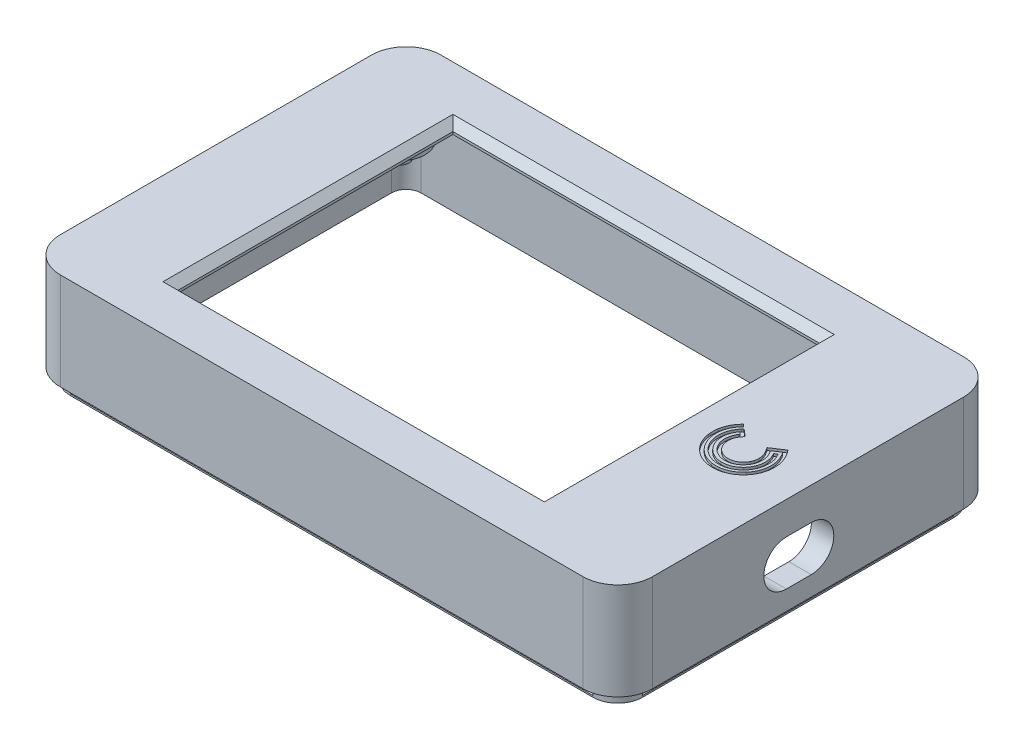
from build123d import *

# Parameters (mm, degrees)
ESQUISSE1_W                 = 92
ESQUISSE1_H                 = 58
ESQUISSE1_W_2               = 58.9
ESQUISSE1_H_2               = 44.2
BOSS_EXTRU_1_DEPTH          = 1.6
CONG_1_R                    = 4
CHANFREIN1_SIZE             = 1.2
ESQUISSE12_R                = 4
BOSS_EXTRU_2_DEPTH          = 4
ESQUISSE13_R                = 1.45
BOSS_EXTRU_3_DEPTH          = 6.4
EXTRU_MINCE3_DEPTH          = 16
EXTRU_MINCE4_DEPTH          = 14
EXTRU_MINCE4_DEPTH_BACK     = 1.6
ENL_V_MAT_EXTRU_3_OK_DEPTH  = 50
ENL_V_MAT_EXTRU_4_OK_DEPTH  = 50
ENL_V_MAT_EXTRU_5_DEPTH     = 84
ENL_V_MAT_EXTRU_8_DEPTH     = 0.4
EXTRU_MINCE5_DEPTH          = 3.6
ENL_V_MAT_EXTRU_11_OK_DEPTH = 4
ENL_V_MAT_EXTRU_15_DEPTH    = 84


with BuildPart() as part:
    # Esquisse1 → Boss.-Extru.1 (new body)
    with BuildSketch(Plane(origin=(0, 0, 0), x_dir=(1, 0, 0), z_dir=(0, 1, 0))):
        Rectangle(ESQUISSE1_W, ESQUISSE1_H)
        with Locations((-2.15, 0)):
            Rectangle(ESQUISSE1_W_2, ESQUISSE1_H_2, mode=Mode.SUBTRACT)
    extrude(amount=BOSS_EXTRU_1_DEPTH)

    # Congé1
    cong_1_edges = [part.edges().sort_by_distance(p)[0] for p in [
        (46, 0.8, 29),
        (-46, 0.8, 29),
        (-46, 0.8, -29),
        (46, 0.8, -29),
    ]]
    fillet(cong_1_edges, radius=CONG_1_R)

    # Chanfrein1
    chanfrein1_edges = [part.edges().sort_by_distance(p)[0] for p in [
        (27.3, 1.6, 0),
        (-2.15, 1.6, -22.1),
        (-31.6, 1.6, 0),
        (-2.15, 1.6, 22.1),
    ]]
    chamfer(chanfrein1_edges, length=CHANFREIN1_SIZE)

    # Esquisse12 → Boss.-Extru.2 (add)
    with BuildSketch(Plane.XZ):
        with Locations(Location((-39, 21, 0), (0, 0, 90))):
            Circle(ESQUISSE12_R)
        with Locations(Location((-39, -21, 0), (0, 0, 90))):
            Circle(ESQUISSE12_R)
        with Locations(Location((39, 21, 0), (0, 0, 90))):
            Circle(ESQUISSE12_R)
        with Locations(Location((39, -21, 0), (0, 0, 90))):
            Circle(ESQUISSE12_R)
    extrude(amount=BOSS_EXTRU_2_DEPTH)

    # Esquisse13 → Boss.-Extru.3 (add)
    with BuildSketch(Plane.XZ):
        with Locations(Location((-39, 21, 0), (0, 0, 270))):
            Circle(ESQUISSE13_R)
        with Locations(Location((-39, -21, 0), (0, 0, 270))):
            Circle(ESQUISSE13_R)
        with Locations(Location((39, -21, 0), (0, 0, 270))):
            Circle(ESQUISSE13_R)
        with Locations(Location((39, 21, 0), (0, 0, 270))):
            Circle(ESQUISSE13_R)
    extrude(amount=BOSS_EXTRU_3_DEPTH)

    # Esquisse32 → Extru.-Mince3 (add)
    with BuildSketch(Plane.XZ):
        with BuildLine():
            Line((46, -25), (46, 25))
            ThreePointArc((46, 25), (44.828427125, 27.828427125), (42, 29))
            Line((42, 29), (-42, 29))
            ThreePointArc((-42, 29), (-44.828427125, 27.828427125), (-46, 25))
            Line((-46, 25), (-46, -25))
            ThreePointArc((-46, -25), (-44.828427125, -27.828427125), (-42, -29))
            Line((-42, -29), (42, -29))
            ThreePointArc((42, -29), (44.828427125, -27.828427125), (46, -25))
        make_face()
        with BuildLine():
            Line((44.4, -25), (44.4, 25))
            ThreePointArc((44.4, 25), (43.697056275, 26.697056275), (42, 27.4))
            Line((42, 27.4), (-42, 27.4))
            ThreePointArc((-42, 27.4), (-43.697056275, 26.697056275), (-44.4, 25))
            Line((-44.4, 25), (-44.4, -25))
            ThreePointArc((-44.4, -25), (-43.697056275, -26.697056275), (-42, -27.4))
            Line((-42, -27.4), (42, -27.4))
            ThreePointArc((42, -27.4), (43.697056275, -26.697056275), (44.4, -25))
        make_face(mode=Mode.SUBTRACT)
    extrude(amount=EXTRU_MINCE3_DEPTH)

    # Esquisse32<2> → Extru.-Mince4 (add, two sides: drawn at the far end of the back side and taken through both)
    with BuildSketch(Plane.XZ.offset(-EXTRU_MINCE4_DEPTH_BACK)):
        with BuildLine():
            Line((47.6, -25), (47.6, 25))
            ThreePointArc((47.6, 25), (45.959797975, 28.959797975), (42, 30.6))
            Line((42, 30.6), (-42, 30.6))
            ThreePointArc((-42, 30.6), (-45.959797975, 28.959797975), (-47.6, 25))
            Line((-47.6, 25), (-47.6, -25))
            ThreePointArc((-47.6, -25), (-45.959797975, -28.959797975), (-42, -30.6))
            Line((-42, -30.6), (42, -30.6))
            ThreePointArc((42, -30.6), (45.959797975, -28.959797975), (47.6, -25))
        make_face()
        with BuildLine():
            Line((46, -25), (46, 25))
            ThreePointArc((46, 25), (44.828427125, 27.828427125), (42, 29))
            Line((42, 29), (-42, 29))
            ThreePointArc((-42, 29), (-44.828427125, 27.828427125), (-46, 25))
            Line((-46, 25), (-46, -25))
            ThreePointArc((-46, -25), (-44.828427125, -27.828427125), (-42, -29))
            Line((-42, -29), (42, -29))
            ThreePointArc((42, -29), (44.828427125, -27.828427125), (46, -25))
        make_face(mode=Mode.SUBTRACT)
    extrude(amount=EXTRU_MINCE4_DEPTH + EXTRU_MINCE4_DEPTH_BACK)

    # Esquisse3D2 → Enlèv. mat.-Extru.3 ok (cut)
    with BuildSketch(Plane(origin=(-46, -15, -25), x_dir=(0, -1, 0), z_dir=(0, 0, 1))):
        Polygon((0, 0), (0.75, 0), (0, 0.75), (-0.75, 0), align=None)
    extrude(amount=ENL_V_MAT_EXTRU_3_OK_DEPTH, mode=Mode.SUBTRACT)

    # Esquisse3D3 → Enlèv. mat.-Extru.4 ok (cut)
    with BuildSketch(Plane(origin=(46, -15, -25), x_dir=(0, -1, 0), z_dir=(0, 0, -1))):
        Polygon((0, 0), (0.75, 0), (0, 0.75), (-0.75, 0), align=None)
    extrude(amount=-ENL_V_MAT_EXTRU_4_OK_DEPTH, mode=Mode.SUBTRACT)

    # Esquisse3D4 → Enlèv. mat.-Extru.5 (cut)
    with BuildSketch(Plane(origin=(42, -15, 29), x_dir=(0, 1, 0), z_dir=(-1, 0, 0))):
        Polygon((0, 0), (0.75, 0), (0, 0.75), (-0.75, 0), align=None)
    extrude(amount=ENL_V_MAT_EXTRU_5_DEPTH, mode=Mode.SUBTRACT)

    # Esquisse45 → Enlèv. mat.-Extru.8 (cut)
    with BuildSketch(Plane(origin=(0, 1.6, 0), x_dir=(1, 0, 0), z_dir=(0, 1, 0))):
        with BuildLine():
            Line((34.215771039, 2.711268822), (34.388486911, 2.91272131))
            Line((34.388486911, 2.91272131), (34.437828255, 2.87228474))
            add(Edge.make_bspline(
                [(34.993798002, 2.403405668), (34.712606668, 2.63893908), (34.463374704, 2.848535174), (34.437828255, 2.87228474)],
                knots=[24, 24, 24, 24, 25, 25, 25, 25], degree=3))
            add(Edge.make_bspline(
                [(35.53485939, 1.947487739), (35.517838447, 1.964749217), (35.274989336, 2.167872256), (34.993798002, 2.403405668)],
                knots=[23, 23, 23, 23, 24, 24, 24, 24], degree=3))
            add(Edge.make_bspline(
                [(35.407029817, 1.746965484), (35.538753823, 1.891748736), (35.558278221, 1.925895857), (35.53485939, 1.947487739)],
                knots=[22, 22, 22, 22, 23, 23, 23, 23], degree=3))
            add(Edge.make_bspline(
                [(34.73787057, 0.131736327), (34.772257454, 0.757180054), (34.985875379, 1.274228405), (35.407029817, 1.746965484)],
                knots=[21, 21, 21, 21, 22, 22, 22, 22], degree=3))
            add(Edge.make_bspline(
                [(34.824246771, -0.689545579), (34.744825467, -0.404001679), (34.720662095, -0.183128188), (34.73787057, 0.131736327)],
                knots=[20, 20, 20, 20, 21, 21, 21, 21], degree=3))
            add(Edge.make_bspline(
                [(35.655401606, -1.944604427), (35.261221021, -1.626853492), (34.962264203, -1.174776992), (34.824246771, -0.689545579)],
                knots=[19, 19, 19, 19, 20, 20, 20, 20], degree=3))
            add(Edge.make_bspline(
                [(39.451885494, -1.096996831), (38.741075896, -2.540513211), (36.903989716, -2.951889554), (35.655401606, -1.944604427)],
                knots=[18, 18, 18, 18, 19, 19, 19, 19], degree=3))
            add(Edge.make_bspline(
                [(39.626454625, -0.648242722), (39.593503049, -0.763720393), (39.514939423, -0.966731068), (39.451885494, -1.096996831)],
                knots=[17, 17, 17, 17, 18, 18, 18, 18], degree=3))
            add(Edge.make_bspline(
                [(39.68880121, -0.00799587), (39.686020024, -0.40438637), (39.681403985, -0.451494633), (39.626454625, -0.648242722)],
                knots=[16, 16, 16, 16, 17, 17, 17, 17], degree=3))
            add(Edge.make_bspline(
                [(39.63752714, 0.624477149), (39.687642863, 0.437705678), (39.691567363, 0.386251979), (39.68880121, -0.00799587)],
                knots=[15, 15, 15, 15, 16, 16, 16, 16], degree=3))
            add(Edge.make_bspline(
                [(39.035470632, 1.854358254), (39.381024576, 1.32481557), (39.537370861, 1.008733346), (39.63752714, 0.624477149)],
                knots=[14, 14, 14, 14, 15, 15, 15, 15], degree=3))
            add(Edge.make_bspline(
                [(38.840436356, 2.153569868), (38.905447781, 2.053832663), (38.970459207, 1.954095459), (39.035470632, 1.854358254)],
                knots=[13, 13, 13, 13, 14, 14, 14, 14], degree=3))
            add(Edge.make_bspline(
                [(39.834971581, 2.806561036), (39.503459839, 2.588897313), (39.171948097, 2.371233591), (38.840436356, 2.153569868)],
                knots=[12, 12, 12, 12, 13, 13, 13, 13], degree=3))
            add(Edge.make_bspline(
                [(40.853166171, 3.472242744), (40.84025013, 3.463762339), (40.381745676, 3.164850621), (39.834971581, 2.806561036)],
                knots=[11, 11, 11, 11, 12, 12, 12, 12], degree=3))
            add(Edge.make_bspline(
                [(41.322512824, 2.873263277), (41.110487671, 3.194021673), (40.881140907, 3.48918852), (40.853166171, 3.472242744)],
                knots=[10, 10, 10, 10, 11, 11, 11, 11], degree=3))
            add(Edge.make_bspline(
                [(42.164389591, 0.703172034), (42.039144997, 1.481871515), (41.75293095, 2.22313078), (41.322512824, 2.873263277)],
                knots=[9, 9, 9, 9, 10, 10, 10, 10], degree=3))
            add(Edge.make_bspline(
                [(42.153866183, -0.796683914), (42.211935368, -0.460678521), (42.215625692, 0.370685238), (42.164389591, 0.703172034)],
                knots=[8, 8, 8, 8, 9, 9, 9, 9], degree=3))
            add(Edge.make_bspline(
                [(41.861482067, -1.851011584), (41.977057069, -1.564693075), (42.095781964, -1.134831959), (42.153866183, -0.796683914)],
                knots=[7, 7, 7, 7, 8, 8, 8, 8], degree=3))
            add(Edge.make_bspline(
                [(39.359312247, -4.518329973), (40.505224046, -3.973538747), (41.381725142, -3.041161031), (41.861482067, -1.851011584)],
                knots=[6, 6, 6, 6, 7, 7, 7, 7], degree=3))
            add(Edge.make_bspline(
                [(38.017088329, -4.946034949), (38.532001159, -4.853223664), (38.903536749, -4.733693322), (39.359312247, -4.518329973)],
                knots=[5, 5, 5, 5, 6, 6, 6, 6], degree=3))
            add(Edge.make_bspline(
                [(36.598412598, -4.970365233), (36.900285903, -5.00676737), (37.772495339, -4.991459466), (38.017088329, -4.946034949)],
                knots=[4, 4, 4, 4, 5, 5, 5, 5], degree=3))
            add(Edge.make_bspline(
                [(34.115882809, -3.922281074), (34.823334364, -4.484361528), (35.722774766, -4.863511942), (36.598412598, -4.970365233)],
                knots=[3, 3, 3, 3, 4, 4, 4, 4], degree=3))
            add(Edge.make_bspline(
                [(33.303027532, -3.113044042), (33.492069824, -3.350073667), (33.879356418, -3.734201694), (34.115882809, -3.922281074)],
                knots=[2, 2, 2, 2, 3, 3, 3, 3], degree=3))
            add(Edge.make_bspline(
                [(32.263988871, -0.641583499), (32.360837793, -1.497222995), (32.750748881, -2.423486915), (33.303027532, -3.113044042)],
                knots=[1, 1, 1, 1, 2, 2, 2, 2], degree=3))
            add(Edge.make_bspline(
                [(32.233653114, -0.384239835), (32.237697881, -0.418552324), (32.251884635, -0.534360731), (32.263988871, -0.641583499)],
                knots=[0, 0, 0, 0, 1, 1, 1, 1], degree=3))
            add(Edge.make_bspline(
                [(32.282692015, 0.802503379), (32.249078968, 0.592749048), (32.213278941, -0.234103906), (32.233653114, -0.384239835)],
                knots=[69, 69, 69, 69, 70, 70, 70, 70], degree=3))
            add(Edge.make_bspline(
                [(33.541417478, 3.37783655), (32.863468483, 2.647627636), (32.443908362, 1.791325897), (32.282692015, 0.802503379)],
                knots=[68, 68, 68, 68, 69, 69, 69, 69], degree=3))
            add(Edge.make_bspline(
                [(33.677456854, 3.526875038), (33.632110396, 3.477195542), (33.586763937, 3.427516046), (33.541417478, 3.37783655)],
                knots=[67, 67, 67, 67, 68, 68, 68, 68], degree=3))
            add(Edge.make_bspline(
                [(33.800978961, 3.418870531), (33.759804925, 3.454872033), (33.71863089, 3.490873536), (33.677456854, 3.526875038)],
                knots=[66, 66, 66, 66, 67, 67, 67, 67], degree=3))
            add(Edge.make_bspline(
                [(34.001155446, 3.241759977), (33.95643037, 3.280643403), (33.866980217, 3.358410256), (33.800978961, 3.418870531)],
                knots=[65, 65, 65, 65, 66, 66, 66, 66], degree=3))
            add(Edge.make_bspline(
                [(34.077809825, 3.172653929), (34.052258365, 3.195689278), (34.026706906, 3.218724627), (34.001155446, 3.241759977)],
                knots=[64, 64, 64, 64, 65, 65, 65, 65], degree=3))
            add(Edge.make_bspline(
                [(33.967737833, 3.059860113), (34.004428497, 3.097458052), (34.041119161, 3.135055991), (34.077809825, 3.172653929)],
                knots=[63, 63, 63, 63, 64, 64, 64, 64], degree=3))
            add(Edge.make_bspline(
                [(32.759384434, -0.276505158), (32.680375392, 0.983990209), (33.11305412, 2.183040998), (33.967737833, 3.059860113)],
                knots=[62, 62, 62, 62, 63, 63, 63, 63], degree=3))
            add(Edge.make_bspline(
                [(36.47798738, -4.420974547), (34.41703451, -4.061530476), (32.890472222, -2.360184548), (32.759384434, -0.276505158)],
                knots=[61, 61, 61, 61, 62, 62, 62, 62], degree=3))
            add(Edge.make_bspline(
                [(37.720574831, -4.451120456), (37.379577563, -4.493725817), (36.805422167, -4.478983598), (36.47798738, -4.420974547)],
                knots=[60, 60, 60, 60, 61, 61, 61, 61], degree=3))
            add(Edge.make_bspline(
                [(40.604754507, -2.920000719), (39.885253263, -3.769912474), (38.855044637, -4.315515505), (37.720574831, -4.451120456)],
                knots=[59, 59, 59, 59, 60, 60, 60, 60], degree=3))
            add(Edge.make_bspline(
                [(41.321123389, 1.759039473), (41.993444292, 0.160111198), (41.723953608, -1.601486853), (40.604754507, -2.920000719)],
                knots=[58, 58, 58, 58, 59, 59, 59, 59], degree=3))
            add(Edge.make_bspline(
                [(40.749598074, 2.759431381), (40.805307009, 2.759040512), (41.167280559, 2.126530295), (41.321123389, 1.759039473)],
                knots=[57, 57, 57, 57, 58, 58, 58, 58], degree=3))
            add(Edge.make_bspline(
                [(40.149122393, 2.38223377), (40.467708071, 2.589988654), (40.738884817, 2.759506548), (40.749598074, 2.759431381)],
                knots=[56, 56, 56, 56, 57, 57, 57, 57], degree=3))
            add(Edge.make_bspline(
                [(39.57008826, 2.007028476), (39.763099638, 2.132096907), (39.956111016, 2.257165339), (40.149122393, 2.38223377)],
                knots=[55, 55, 55, 55, 56, 56, 56, 56], degree=3))
            add(Edge.make_bspline(
                [(39.697143998, 1.791861334), (39.654792085, 1.863583715), (39.612440173, 1.935306095), (39.57008826, 2.007028476)],
                knots=[54, 54, 54, 54, 55, 55, 55, 55], degree=3))
            add(Edge.make_bspline(
                [(40.189850119, 0.552033678), (40.121848644, 0.938207025), (39.957623292, 1.352911345), (39.697143998, 1.791861334)],
                knots=[53, 53, 53, 53, 54, 54, 54, 54], degree=3))
            add(Edge.make_bspline(
                [(40.173086289, -0.615651176), (40.235095008, -0.328956831), (40.245581991, 0.249513934), (40.189850119, 0.552033678)],
                knots=[52, 52, 52, 52, 53, 53, 53, 53], degree=3))
            add(Edge.make_bspline(
                [(37.795227445, -2.973142025), (39.00338927, -2.718059735), (39.905331581, -1.824430145), (40.173086289, -0.615651176)],
                knots=[51, 51, 51, 51, 52, 52, 52, 52], degree=3))
            add(Edge.make_bspline(
                [(37.291373641, -3.016747496), (37.482114712, -3.011657518), (37.705100787, -2.991794483), (37.795227445, -2.973142025)],
                knots=[50, 50, 50, 50, 51, 51, 51, 51], degree=3))
            add(Edge.make_bspline(
                [(36.349388784, -2.898714912), (36.689393845, -2.99752454), (36.912034151, -3.026942485), (37.291373641, -3.016747496)],
                knots=[49, 49, 49, 49, 50, 50, 50, 50], degree=3))
            add(Edge.make_bspline(
                [(35.420567635, -2.431505324), (35.642245801, -2.598052956), (36.092781759, -2.824060753), (36.349388784, -2.898714912)],
                knots=[48, 48, 48, 48, 49, 49, 49, 49], degree=3))
            add(Edge.make_bspline(
                [(34.340556672, -0.913284099), (34.529261097, -1.503866231), (34.923900588, -2.061609151), (35.420567635, -2.431505324)],
                knots=[47, 47, 47, 47, 48, 48, 48, 48], degree=3))
            add(Edge.make_bspline(
                [(34.690888161, 1.681279159), (34.209897723, 0.926118003), (34.074318025, -0.073598173), (34.340556672, -0.913284099)],
                knots=[46, 46, 46, 46, 47, 47, 47, 47], degree=3))
            add(Edge.make_bspline(
                [(34.807899243, 1.866878021), (34.80788421, 1.864735369), (34.755874273, 1.781532769), (34.690888161, 1.681279159)],
                knots=[45, 45, 45, 45, 46, 46, 46, 46], degree=3))
            add(Edge.make_bspline(
                [(34.633269207, 2.020239009), (34.72913228, 1.940284404), (34.80792931, 1.871163323), (34.807899243, 1.866878021)],
                knots=[44, 44, 44, 44, 45, 45, 45, 45], degree=3))
            add(Edge.make_bspline(
                [(34.460736721, 2.16715701), (34.51824755, 2.118184343), (34.575758378, 2.069211676), (34.633269207, 2.020239009)],
                knots=[43, 43, 43, 43, 44, 44, 44, 44], degree=3))
            add(Edge.make_bspline(
                [(34.408877119, 2.105380923), (34.426163653, 2.125972952), (34.443450187, 2.146564981), (34.460736721, 2.16715701)],
                knots=[42, 42, 42, 42, 43, 43, 43, 43], degree=3))
            add(Edge.make_bspline(
                [(34.033658336, 1.460900999), (34.118574748, 1.653153317), (34.318104023, 1.994594457), (34.408877119, 2.105380923)],
                knots=[41, 41, 41, 41, 42, 42, 42, 42], degree=3))
            add(Edge.make_bspline(
                [(33.719224204, 0.012460781), (33.722907397, 0.537410363), (33.81807816, 0.969579499), (34.033658336, 1.460900999)],
                knots=[40, 40, 40, 40, 41, 41, 41, 41], degree=3))
            add(Edge.make_bspline(
                [(34.721837792, -2.458744193), (34.055878352, -1.785531504), (33.712534323, -0.941019071), (33.719224204, 0.012460781)],
                knots=[39, 39, 39, 39, 40, 40, 40, 40], degree=3))
            add(Edge.make_bspline(
                [(35.640600025, -3.138016131), (35.290422912, -2.961995887), (35.026087154, -2.767293119), (34.721837792, -2.458744193)],
                knots=[38, 38, 38, 38, 39, 39, 39, 39], degree=3))
            add(Edge.make_bspline(
                [(37.073650814, -3.508053964), (36.52741002, -3.484936574), (36.116757599, -3.377060237), (35.640600025, -3.138016131)],
                knots=[37, 37, 37, 37, 38, 38, 38, 38], degree=3))
            add(Edge.make_bspline(
                [(39.673490037, -2.495629125), (38.950650598, -3.210523778), (38.07615608, -3.551514687), (37.073650814, -3.508053964)],
                knots=[36, 36, 36, 36, 37, 37, 37, 37], degree=3))
            add(Edge.make_bspline(
                [(40.527060504, -1.166680507), (40.349972886, -1.668985867), (40.074834443, -2.097749542), (39.673490037, -2.495629125)],
                knots=[35, 35, 35, 35, 36, 36, 36, 36], degree=3))
            add(Edge.make_bspline(
                [(40.321640618, 1.622487415), (40.776252183, 0.75576673), (40.850652317, -0.245422723), (40.527060504, -1.166680507)],
                knots=[34, 34, 34, 34, 35, 35, 35, 35], degree=3))
            add(Edge.make_bspline(
                [(40.211860802, 1.852546917), (40.207544887, 1.848292234), (40.256091041, 1.745092979), (40.321640618, 1.622487415)],
                knots=[33, 33, 33, 33, 34, 34, 34, 34], degree=3))
            add(Edge.make_bspline(
                [(40.646334261, 2.111209808), (40.629233692, 2.117746376), (40.267882172, 1.901475222), (40.211860802, 1.852546917)],
                knots=[32, 32, 32, 32, 33, 33, 33, 33], degree=3))
            add(Edge.make_bspline(
                [(41.056039605, 1.244847124), (40.984729876, 1.46818664), (40.686955793, 2.098072459), (40.646334261, 2.111209808)],
                knots=[31, 31, 31, 31, 32, 32, 32, 32], degree=3))
            add(Edge.make_bspline(
                [(41.238955796, 0.118635499), (41.229167388, 0.562253551), (41.18190174, 0.853995173), (41.056039605, 1.244847124)],
                knots=[30, 30, 30, 30, 31, 31, 31, 31], degree=3))
            add(Edge.make_bspline(
                [(41.018815918, -1.351917853), (41.193673944, -0.853862791), (41.252118844, -0.457856484), (41.238955796, 0.118635499)],
                knots=[29, 29, 29, 29, 30, 30, 30, 30], degree=3))
            add(Edge.make_bspline(
                [(40.001151815, -2.926437052), (40.449715538, -2.498755243), (40.809150796, -1.941909929), (41.018815918, -1.351917853)],
                knots=[28, 28, 28, 28, 29, 29, 29, 29], degree=3))
            add(Edge.make_bspline(
                [(34.756272455, -3.207299936), (36.332831097, -4.42477247), (38.549094757, -4.306672089), (40.001151815, -2.926437052)],
                knots=[27, 27, 27, 27, 28, 28, 28, 28], degree=3))
            add(Edge.make_bspline(
                [(34.215771039, 2.711268822), (32.654499646, 0.890231739), (32.897852252, -1.770333077), (34.756272455, -3.207299936)],
                knots=[26, 26, 26, 26, 27, 27, 27, 27], degree=3))
        make_face()
    extrude(amount=-ENL_V_MAT_EXTRU_8_DEPTH, mode=Mode.SUBTRACT)

    # Esquisse48 → Extru.-Mince5 (add)
    with BuildSketch(Plane(origin=(47.6, 0, 0), x_dir=(0, 0, -1), z_dir=(1, 0, 0))):
        with BuildLine():
            Line((-3.5, -2.625), (0.5, -2.625))
            ThreePointArc((0.5, -2.625), (5.125, -7.25), (0.5, -11.875))
            Line((0.5, -11.875), (-3.5, -11.875))
            ThreePointArc((-3.5, -11.875), (-8.125, -7.25), (-3.5, -2.625))
        make_face()
        with BuildLine():
            Line((-3.5, -3.625), (0.5, -3.625))
            ThreePointArc((0.5, -3.625), (4.125, -7.25), (0.5, -10.875))
            Line((0.5, -10.875), (-3.5, -10.875))
            ThreePointArc((-3.5, -10.875), (-7.125, -7.25), (-3.5, -3.625))
        make_face(mode=Mode.SUBTRACT)
    extrude(amount=-EXTRU_MINCE5_DEPTH)

    # Esquisse48<2> → Enlèv. mat.-Extru.11 ok (cut)
    with BuildSketch(Plane(origin=(47.6, 0, 0), x_dir=(0, 0, -1), z_dir=(1, 0, 0))):
        with BuildLine():
            Line((0.5, -10.875), (-3.5, -10.875))
            ThreePointArc((-3.5, -10.875), (-7.125, -7.25), (-3.5, -3.625))
            Line((-3.5, -3.625), (0.5, -3.625))
            ThreePointArc((0.5, -3.625), (4.125, -7.25), (0.5, -10.875))
        make_face()
    extrude(amount=-ENL_V_MAT_EXTRU_11_OK_DEPTH, mode=Mode.SUBTRACT)

    # Esquisse3D6 → Enlèv. mat.-Extru.15 (cut)
    with BuildSketch(Plane(origin=(-42, -15, -29), x_dir=(0, -1, 0), z_dir=(-1, 0, 0))):
        Polygon((0, 0), (0.75, 0), (0, 0.75), (-0.75, 0), align=None)
    extrude(amount=-ENL_V_MAT_EXTRU_15_DEPTH, mode=Mode.SUBTRACT)


solid = part.part
